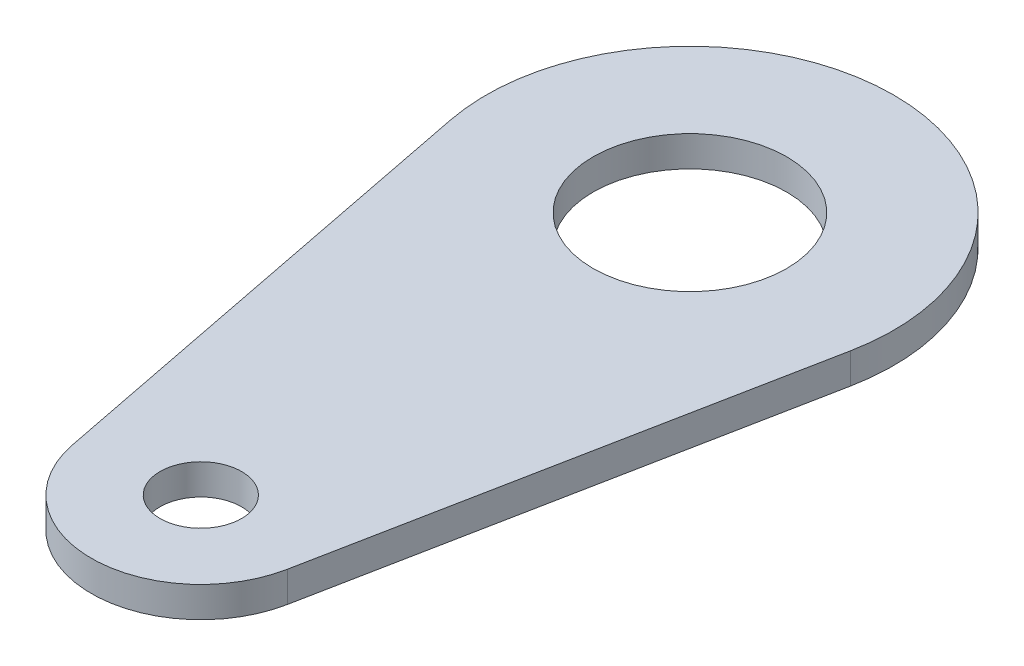
from build123d import *

# Parameters (mm, degrees)
SKETCH1_R               = 3.999999916
BOSS_EXTRUDE1_DEPTH     = 3
CUT_EXTRUDE3_DEPTH      = 14052.939444196
CUT_EXTRUDE3_DEPTH_BACK = 14052.939444196
SKETCH3_R               = 9.5


with BuildPart() as part:
    # Sketch1 → Boss-Extrude1 (new body)
    with BuildSketch(Plane(origin=(0, 0, 0), x_dir=(1, 0, 0), z_dir=(0, 1, 0))):
        with BuildLine():
            Line((-13667.630300179, 3154.015259161), (-13676.700320557, 3200.215044723))
            ThreePointArc((-13676.700320557, 3200.215044723), (-13657.074947978, 3224.067930782), (-13637.449575399, 3200.215044723))
            Line((-13637.449575399, 3200.215044723), (-13646.519595777, 3154.015259161))
            ThreePointArc((-13646.519595777, 3154.015259161), (-13657.074947978, 3145.314842225), (-13667.630300179, 3154.015259161))
        make_face()
        with Locations(Location((-13657.074947978, 3156.067931204, 0), (0, 0, 269.999999999))):
            Circle(SKETCH1_R, mode=Mode.SUBTRACT)
        Polygon((-13663.074951578, 3198.067969394), (-13651.074950322, 3198.067909928), (-13651.074919654, 3210.067922748), (-13663.074916837, 3210.067922748), align=None, mode=Mode.SUBTRACT)
    extrude(amount=BOSS_EXTRUDE1_DEPTH)

    # Sketch3 → Cut-Extrude3 (cut, two sides: drawn at the far end of the back side and taken through both)
    with BuildSketch(Plane.XZ.offset(-CUT_EXTRUDE3_DEPTH_BACK)):
        with Locations(Location((-13657.07493358, -3204.067916338, 0), (0, 0, 270))):
            Circle(SKETCH3_R)
    extrude(amount=CUT_EXTRUDE3_DEPTH + CUT_EXTRUDE3_DEPTH_BACK, mode=Mode.SUBTRACT)


solid = part.part
